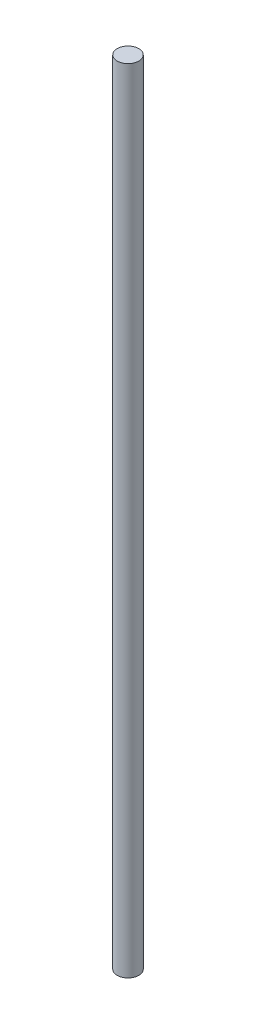
from build123d import *

# Parameters (mm, degrees)
SKETCH_1_R      = 1.5
EXTRUDE_1_DEPTH = 110


with BuildPart() as part:
    # 草图1 → 凸台-拉伸1 (new body)
    with BuildSketch(Plane(origin=(0, 0, 0), x_dir=(1, 0, 0), z_dir=(0, 1, 0))):
        with Locations(Location((0, 0, 0), (0, 0, 270))):
            Circle(SKETCH_1_R)
    extrude(amount=EXTRUDE_1_DEPTH)


solid = part.part
